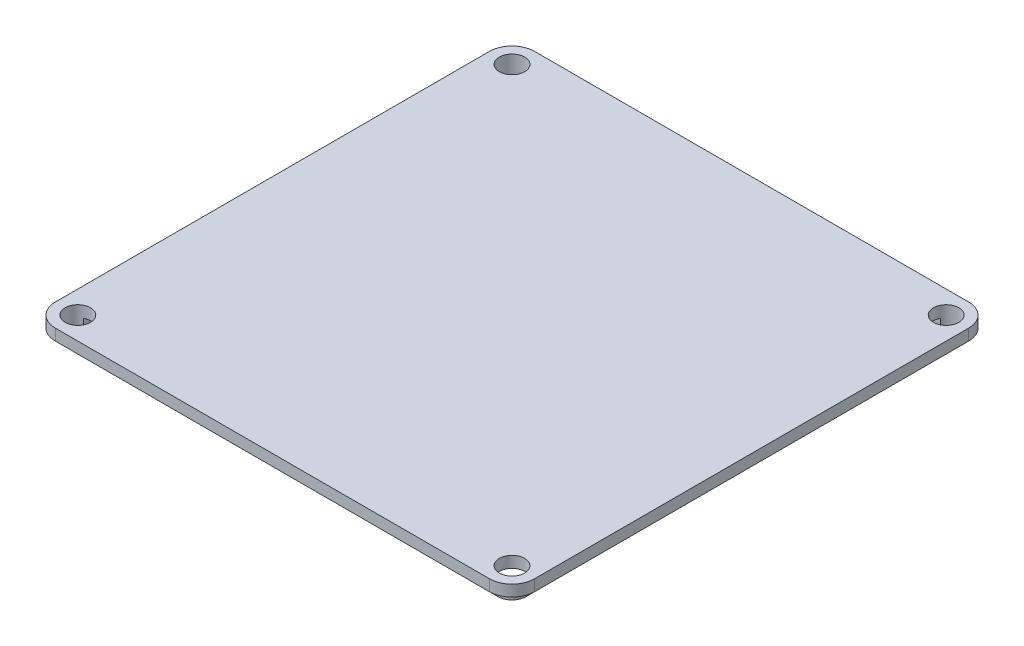
from build123d import *

# Parameters (mm, degrees)
BOSS_EXTRUDE1_DEPTH = 4
BOSS_EXTRUDE2_DEPTH = 3
SKETCH4_R           = 4.5
CUT_EXTRUDE2_DEPTH  = 121.411793442


with BuildPart() as part:
    # Sketch1 → Boss-Extrude1 (new body)
    with BuildSketch(Plane(origin=(0, 0, 0), x_dir=(1, 0, 0), z_dir=(0, 1, 0))):
        with BuildLine():
            Line((-77, 85), (77, 85))
            ThreePointArc((77, 85), (82.656854249, 82.656854249), (85, 77))
            Line((85, 77), (85, -77))
            ThreePointArc((85, -77), (82.656854249, -82.656854249), (77, -85))
            Line((77, -85), (-77, -85))
            ThreePointArc((-77, -85), (-82.656854249, -82.656854249), (-85, -77))
            Line((-85, -77), (-85, 77))
            ThreePointArc((-85, 77), (-82.656854249, 82.656854249), (-77, 85))
        make_face()
    extrude(amount=BOSS_EXTRUDE1_DEPTH)

    # Sketch2 → Boss-Extrude2 (add)
    with BuildSketch(Plane.XZ):
        with BuildLine():
            Line((77, 82), (-77, 82))
            ThreePointArc((-77, 82), (-80.535533906, 80.535533906), (-82, 77))
            Line((-82, 77), (-82, -77))
            ThreePointArc((-82, -77), (-80.535533906, -80.535533906), (-77, -82))
            Line((-77, -82), (77, -82))
            ThreePointArc((77, -82), (80.535533906, -80.535533906), (82, -77))
            Line((82, -77), (82, 77))
            ThreePointArc((82, 77), (80.535533906, 80.535533906), (77, 82))
        make_face()
        with BuildLine():
            ThreePointArc((79, 77), (78.414213562, 78.414213562), (77, 79))
            Line((77, 79), (-77, 79))
            ThreePointArc((-77, 79), (-78.414213562, 78.414213562), (-79, 77))
            Line((-79, 77), (-79, -77))
            ThreePointArc((-79, -77), (-78.414213562, -78.414213562), (-77, -79))
            Line((-77, -79), (77, -79))
            ThreePointArc((77, -79), (78.414213562, -78.414213562), (79, -77))
            Line((79, -77), (79, 77))
        make_face(mode=Mode.SUBTRACT)
    extrude(amount=BOSS_EXTRUDE2_DEPTH)

    # Sketch4 → Cut-Extrude2 (cut, through all)
    with BuildSketch(Plane.XZ.offset(3)):
        with Locations(Location((77, 77, 0), (0, 0, 270))):
            Circle(SKETCH4_R)
        with Locations(Location((77, -77, 0), (0, 0, 270))):
            Circle(SKETCH4_R)
        with Locations(Location((-77, -77, 0), (0, 0, 270))):
            Circle(SKETCH4_R)
        with Locations(Location((-77, 77, 0), (0, 0, 270))):
            Circle(SKETCH4_R)
    extrude(amount=-CUT_EXTRUDE2_DEPTH, mode=Mode.SUBTRACT)


solid = part.part
